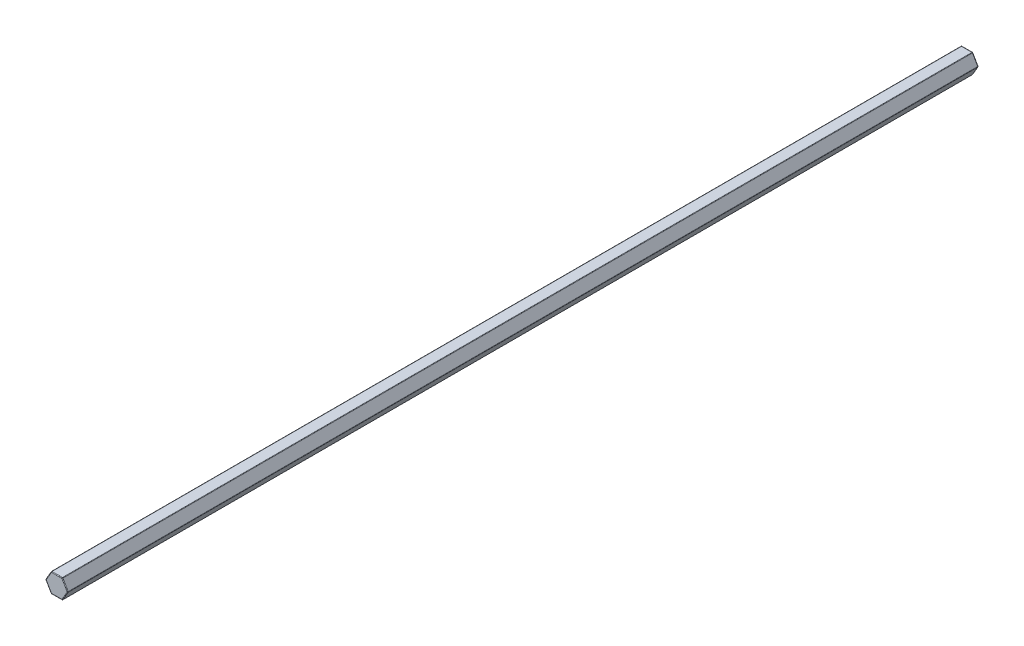
from build123d import *

# Parameters (mm, degrees)
BOSS_EXTRUDE1_DEPTH = 150
FILLET1_R           = 0.2


with BuildPart() as part:
    # Sketch1 → Boss-Extrude1 (new, symmetric)
    with BuildSketch(Plane.XY):
        Polygon((3.666174209, 0), (1.833087105, 3.175), (-1.833087105, 3.175), (-3.666174209, 0), (-1.833087105, -3.175), (1.833087105, -3.175), align=None)
    extrude(amount=BOSS_EXTRUDE1_DEPTH, both=True)

    # Fillet1
    fillet1_edges = [part.edges().sort_by_distance(p)[0] for p in [
        (2.749630657, 1.5875, -150),
        (-2.749630657, 1.5875, -150),
        (0, -3.175, -150),
        (-3.666174209, 0, 0),
        (-1.833087105, -3.175, 0),
        (-2.749630657, -1.5875, -150),
        (1.833087105, -3.175, 0),
        (3.666174209, 0, 0),
        (2.749630657, -1.5875, -150),
        (1.833087105, 3.175, 0),
        (-1.833087105, 3.175, 0),
        (0, 3.175, -150),
        (0, -3.175, 150),
        (-2.749630657, -1.5875, 150),
        (-2.749630657, 1.5875, 150),
        (0, 3.175, 150),
        (2.749630657, 1.5875, 150),
        (2.749630657, -1.5875, 150),
    ]]
    fillet(fillet1_edges, radius=FILLET1_R)


solid = part.part
